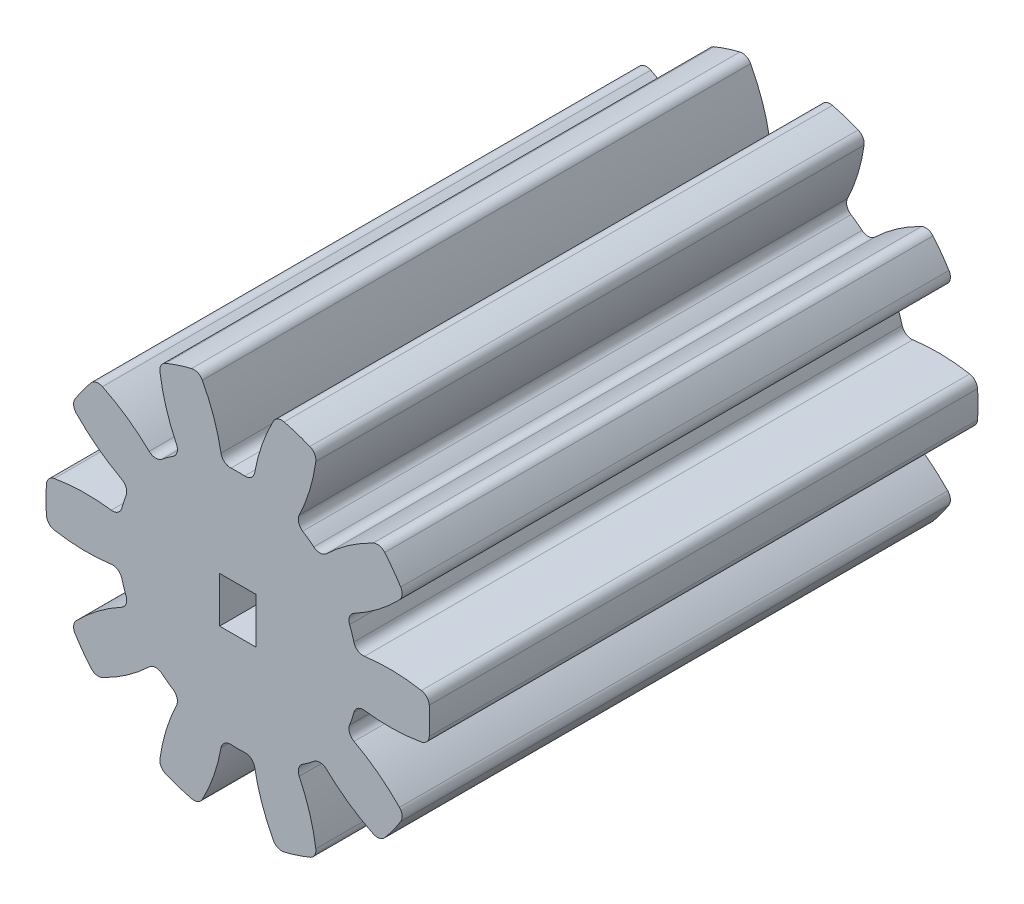
from build123d import *

# Parameters (mm, degrees)
SKETCH1_R                = 21
SKETCH1_R_2              = 5
BOSS_EXTRUDE1_DEPTH      = 30
CUT_EXTRUDE1_DEPTH       = 43.213741838
FILLET1_R                = 1.05
CIRPATTERN1_COUNT        = 10
FILLET1_OF_CIRPATTERN1_R = 1.05
SKETCH3_R                = 6.332522558
BOSS_EXTRUDE2_DEPTH      = 60
SKETCH4_W                = 4
SKETCH4_H                = 5
CUT_EXTRUDE2_DEPTH       = 5
SKETCH5_R                = 7.5
CUT_EXTRUDE3_DEPTH       = 20


with BuildPart() as part:
    # Sketch1 → Boss-Extrude1 (new, symmetric)
    with BuildSketch(Plane.XY):
        Circle(SKETCH1_R)
        Circle(SKETCH1_R_2, mode=Mode.SUBTRACT)
    extrude(amount=BOSS_EXTRUDE1_DEPTH, both=True)

    # Sketch2 → Cut-Extrude1 (cut, symmetric)
    with BuildSketch(Plane.XY):
        with BuildLine():
            ThreePointArc((1.695854584, 13.014979917), (0, 13.125), (-1.695854584, 13.014979917))
            ThreePointArc((-1.695854584, 13.014979917), (-2.607836125, 16.916940164), (-4.2770727, 20.55983096))
            ThreePointArc((-4.2770727, 20.55983096), (0, 21), (4.2770727, 20.55983096))
            ThreePointArc((4.2770727, 20.55983096), (2.607836125, 16.916940164), (1.695854584, 13.014979917))
        make_face()
    cut_extrude1 = extrude(amount=CUT_EXTRUDE1_DEPTH, both=True, mode=Mode.SUBTRACT)

    # Fillet1
    fillet1_edges = [part.edges().sort_by_distance(p)[0] for p in [
        (1.695854584, 13.014979917, 0),
        (-1.695854584, 13.014979917, 0),
        (-4.2770727, 20.55983096, 0),
        (4.2770727, 20.55983096, 0),
    ]]
    fillet(fillet1_edges, radius=FILLET1_R)

    # CirPattern1: Cut-Extrude1 ×10 about axis
    cirpattern1_axis = Axis((0, 0, 30), (0, 0, -1))
    for i in range(1, CIRPATTERN1_COUNT):
        add(cut_extrude1.rotate(cirpattern1_axis, i * 360 / CIRPATTERN1_COUNT), mode=Mode.SUBTRACT)

    # Fillet1 of CirPattern1
    fillet1_of_cirpattern1_edges = [part.edges().sort_by_distance(p)[0] for p in [
        (9.021988432, 9.53254162, 0),
        (6.278038075, 11.526138248, 0),
        (8.624540927, 19.147252905, 0),
        (15.544989929, 14.119252392, 0),
        (12.902029346, 2.408996423, 0),
        (11.853933573, 5.634703528, 0),
        (18.231873058, 10.421075031, 0),
        (20.875249359, 2.285599306, 0),
        (11.853933573, -5.634703528, 0),
        (12.902029346, -2.408996423, 0),
        (20.875249359, -2.285599306, 0),
        (18.231873058, -10.421075031, 0),
        (6.278038075, -11.526138248, 0),
        (9.021988432, -9.53254162, 0),
        (15.544989929, -14.119252392, 0),
        (8.624540927, -19.147252905, 0),
        (-1.695854584, -13.014979917, 0),
        (1.695854584, -13.014979917, 0),
        (4.2770727, -20.55983096, 0),
        (-4.2770727, -20.55983096, 0),
        (-9.021988432, -9.53254162, 0),
        (-6.278038075, -11.526138248, 0),
        (-8.624540927, -19.147252905, 0),
        (-15.544989929, -14.119252392, 0),
        (-12.902029346, -2.408996423, 0),
        (-11.853933573, -5.634703528, 0),
        (-18.231873058, -10.421075031, 0),
        (-20.875249359, -2.285599306, 0),
        (-11.853933573, 5.634703528, 0),
        (-12.902029346, 2.408996423, 0),
        (-20.875249359, 2.285599306, 0),
        (-18.231873058, 10.421075031, 0),
        (-6.278038075, 11.526138248, 0),
        (-9.021988432, 9.53254162, 0),
        (-15.544989929, 14.119252392, 0),
        (-8.624540927, 19.147252905, 0),
    ]]
    fillet(fillet1_of_cirpattern1_edges, radius=FILLET1_OF_CIRPATTERN1_R)

    # Sketch3 → Boss-Extrude2 (add)
    with BuildSketch(Plane(origin=(0, 0, -30), x_dir=(-1, 0, 0), z_dir=(0, 0, -1))):
        Circle(SKETCH3_R)
    extrude(amount=-BOSS_EXTRUDE2_DEPTH)

    # Sketch4 → Cut-Extrude2 (cut)
    with BuildSketch(Plane.XY.offset(30)):
        Rectangle(SKETCH4_W, SKETCH4_H)
    extrude(amount=-CUT_EXTRUDE2_DEPTH, mode=Mode.SUBTRACT)

    # Sketch5 → Cut-Extrude3 (cut)
    with BuildSketch(Plane(origin=(0, 0, -30), x_dir=(-1, 0, 0), z_dir=(0, 0, -1))):
        Circle(SKETCH5_R)
    extrude(amount=-CUT_EXTRUDE3_DEPTH, mode=Mode.SUBTRACT)


solid = part.part
